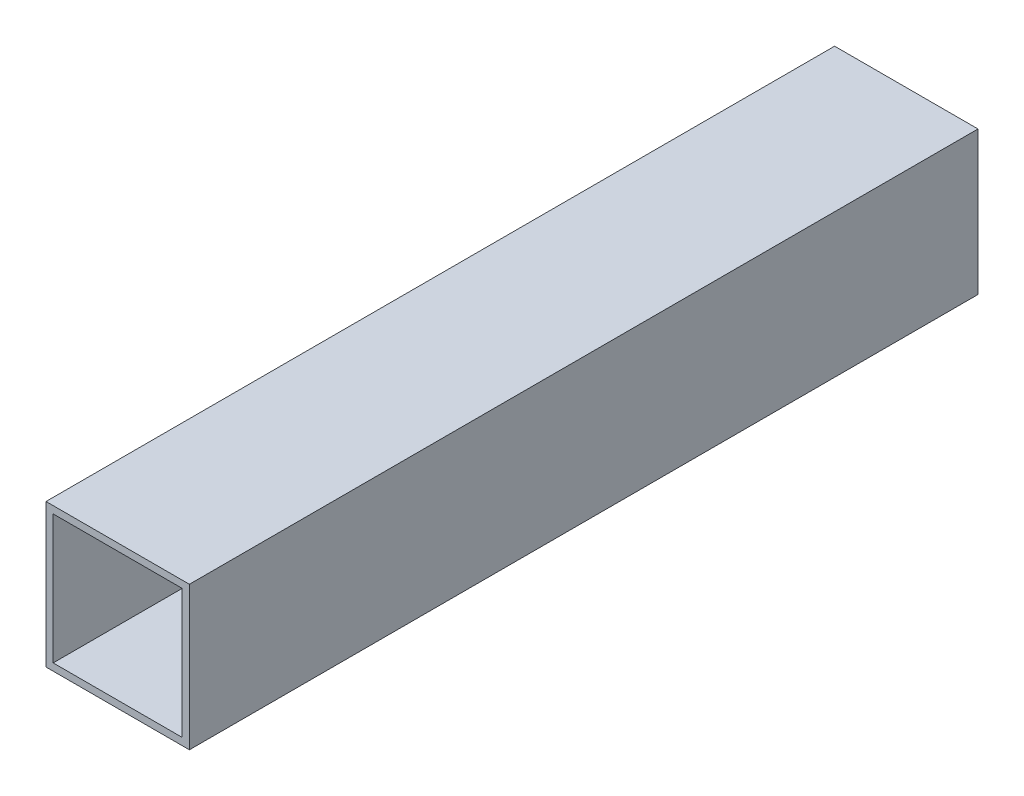
from build123d import *

# Parameters (mm, degrees)
CROQUIS1_W            = 40
CROQUIS1_H            = 40
CROQUIS1_W_2          = 36
CROQUIS1_H_2          = 36
EXTRUIR_L_MINA1_DEPTH = 220


with BuildPart() as part:
    # Croquis1 → Extruir-Lámina1 (new body)
    with BuildSketch(Plane.XY):
        Rectangle(CROQUIS1_W, CROQUIS1_H)
        Rectangle(CROQUIS1_W_2, CROQUIS1_H_2, mode=Mode.SUBTRACT)
    extrude(amount=EXTRUIR_L_MINA1_DEPTH)


solid = part.part
